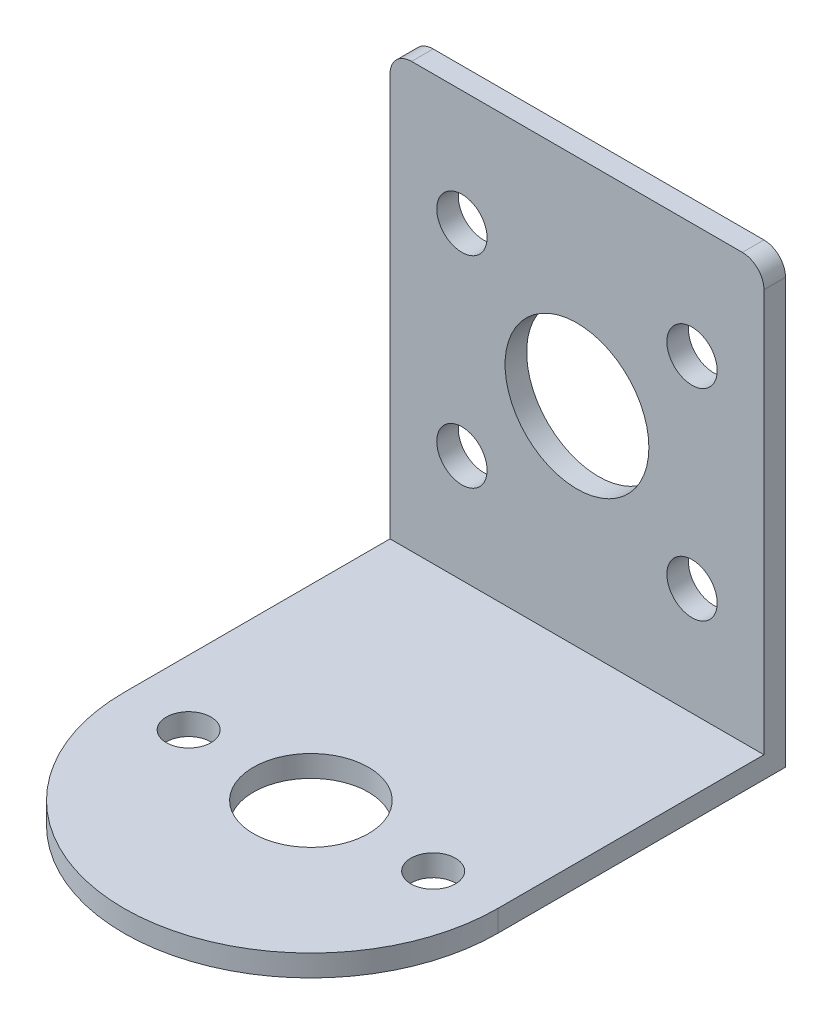
from build123d import *

# Parameters (mm, degrees)
SKETCH_1_W          = 26
SKETCH_1_H          = 31
EXTRUDE_1_DEPTH     = 1.5
EXTRUDE_2_DEPTH     = 1.5
SKETCH_3_R          = 4
SKETCH_3_R_2        = 1.55
CUT_EXTRUDE_1_DEPTH = 1000
FILLET_1_R          = 1.5
SKETCH_4_R          = 5
SKETCH_4_R_2        = 1.75
CUT_EXTRUDE_2_DEPTH = 100


with BuildPart() as part:
    # 草图1 → 凸台-拉伸1 (new body)
    with BuildSketch(Plane.XY):
        Rectangle(SKETCH_1_W, SKETCH_1_H)
    extrude(amount=EXTRUDE_1_DEPTH)

    # 草图2 → 凸台-拉伸2 (add)
    with BuildSketch(Plane.XZ.offset(15.5)):
        with BuildLine():
            Line((-13, 0), (13, 0))
            Line((13, 0), (13, 20))
            ThreePointArc((13, 20), (0, 33), (-13, 20))
            Line((-13, 20), (-13, 0))
        make_face()
    extrude(amount=-EXTRUDE_2_DEPTH)

    # 草图3 → 切除-拉伸1 (cut)
    with BuildSketch(Plane.XZ.offset(15.5)):
        with Locations(Location((0, 20, 0), (0, 0, 270))):
            Circle(SKETCH_3_R)
        with Locations(Location((8.5, 20, 0), (0, 0, 270))):
            Circle(SKETCH_3_R_2)
        with Locations(Location((-8.5, 20, 0), (0, 0, 270))):
            Circle(SKETCH_3_R_2)
    extrude(amount=-CUT_EXTRUDE_1_DEPTH, mode=Mode.SUBTRACT)

    # 圆角1
    fillet_1_edges = [part.edges().sort_by_distance(p)[0] for p in [
        (-13, 15.5, 0.75),
        (13, 15.5, 0.75),
    ]]
    fillet(fillet_1_edges, radius=FILLET_1_R)

    # 草图4 → 切除-拉伸2 (cut)
    with BuildSketch(Plane.XY.offset(1.5)):
        with Locations((0, 0.5)):
            Circle(SKETCH_4_R)
        with Locations((-8, 7.5)):
            Circle(SKETCH_4_R_2)
        with Locations((8, 7.5)):
            Circle(SKETCH_4_R_2)
        with Locations((-8, -6.5)):
            Circle(SKETCH_4_R_2)
        with Locations((8, -6.5)):
            Circle(SKETCH_4_R_2)
    extrude(amount=-CUT_EXTRUDE_2_DEPTH, mode=Mode.SUBTRACT)


solid = part.part
